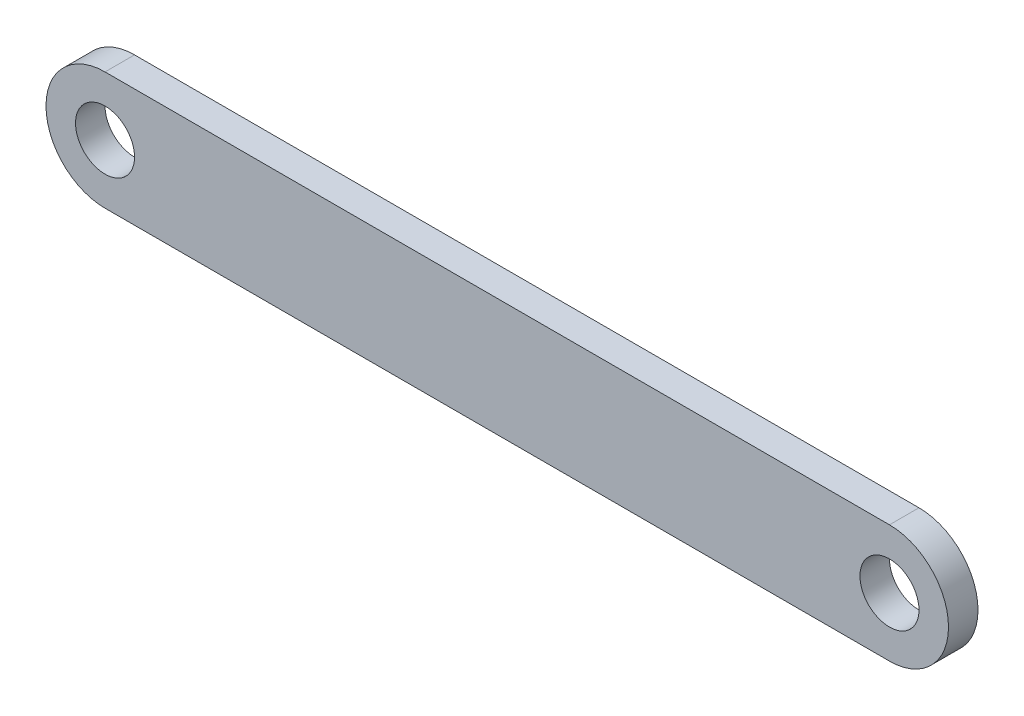
from build123d import *

# Parameters (mm, degrees)
SKETCH1_R      = 1
EXTRUDE1_DEPTH = 1


with BuildPart() as part:
    # Sketch1 → Extrude1 (new body)
    with BuildSketch(Plane.XY):
        with BuildLine():
            ThreePointArc((0, 2), (-2, 0), (0, -2))
            Line((0, -2), (26.58, -2))
            ThreePointArc((26.58, -2), (28.58, 0), (26.58, 2))
            Line((26.58, 2), (0, 2))
        make_face()
        Circle(SKETCH1_R, mode=Mode.SUBTRACT)
        with Locations((26.58, 0)):
            Circle(SKETCH1_R, mode=Mode.SUBTRACT)
    extrude(amount=-EXTRUDE1_DEPTH)


solid = part.part
